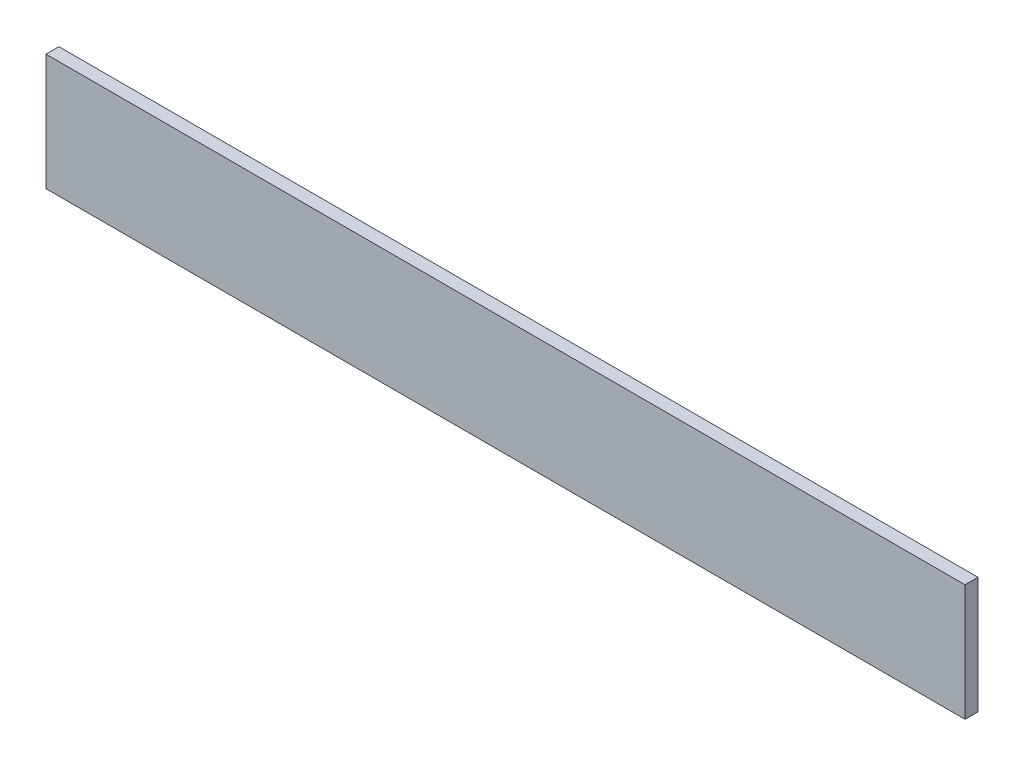
from build123d import *

# Parameters (mm, degrees)
SKETCH1_W           = 901.7
SKETCH1_H           = 114.3
BOSS_EXTRUDE1_DEPTH = 12.7


with BuildPart() as part:
    # Sketch1 → Boss-Extrude1 (new body)
    with BuildSketch(Plane.XY):
        with Locations((450.85, 57.15)):
            Rectangle(SKETCH1_W, SKETCH1_H)
    extrude(amount=BOSS_EXTRUDE1_DEPTH)


solid = part.part
